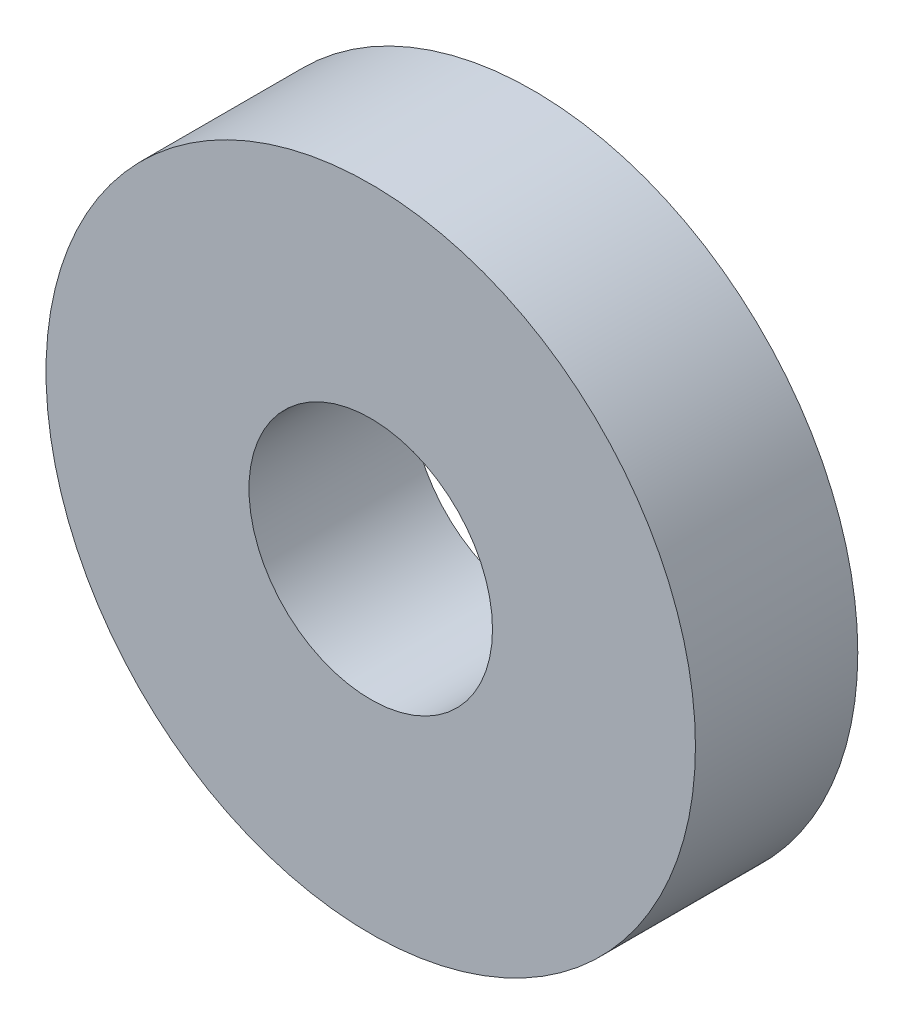
from build123d import *

# Parameters (mm, degrees)
SKETCH_1_R      = 20
SKETCH_1_R_2    = 7.5
EXTRUDE_1_DEPTH = 5


with BuildPart() as part:
    # 草图1 → 凸台-拉伸1 (new, symmetric)
    with BuildSketch(Plane.XY):
        Circle(SKETCH_1_R)
        Circle(SKETCH_1_R_2, mode=Mode.SUBTRACT)
    extrude(amount=EXTRUDE_1_DEPTH, both=True)


solid = part.part
